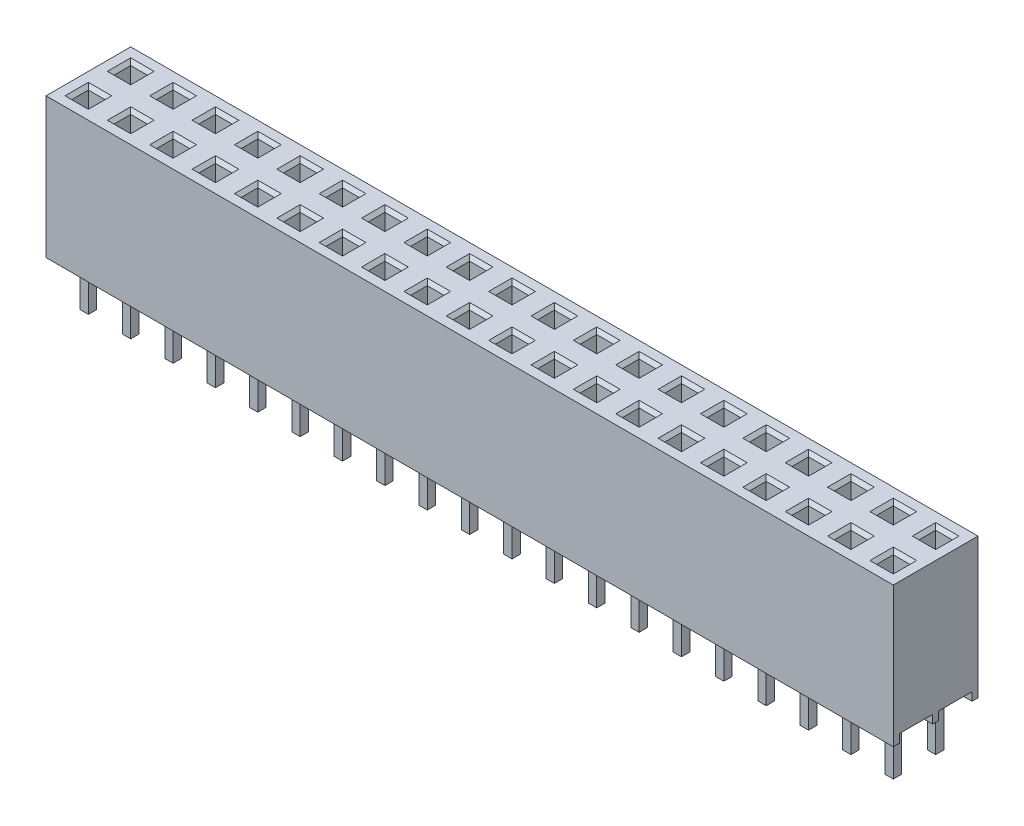
from build123d import *

# Parameters (mm, degrees)
SKETCH_1_W                         = 12.7
SKETCH_1_H                         = 5.08
EXTRUDE_1_DEPTH                    = 8.4
CUT_EXTRUDE_1_REACH                = 17.437
SKETCH_2_W                         = 2
SKETCH_2_H                         = 0.5
CUT_EXTRUDE_2_REACH                = 12.449
SKETCH_3_W                         = 1
SKETCH_3_H                         = 1
CHAMFER_1_SIZE                     = 0.2
PATTERN_LINEAR_3_COUNT             = 4
PATTERN_LINEAR_3_PITCH             = 12.7
CHAMFER_1_OF_PATTERN_LINEAR_3_SIZE = 0.2
EXTRUDE_2_DEPTH                    = 3.2
EXTRUDE_2_DEPTH_BACK               = 3.2
SKETCH_4_W                         = 0.5
SKETCH_4_H                         = 0.5
EXTRUDE_2_2_DEPTH                  = 3.2
EXTRUDE_2_2_DEPTH_BACK             = 3.2
EXTRUDE_2_3_DEPTH                  = 3.2
EXTRUDE_2_3_DEPTH_BACK             = 3.2
EXTRUDE_2_4_DEPTH                  = 3.2
EXTRUDE_2_4_DEPTH_BACK             = 3.2
EXTRUDE_2_5_DEPTH                  = 3.2
EXTRUDE_2_5_DEPTH_BACK             = 3.2
EXTRUDE_2_6_DEPTH                  = 3.2
EXTRUDE_2_6_DEPTH_BACK             = 3.2
EXTRUDE_2_7_DEPTH                  = 3.2
EXTRUDE_2_7_DEPTH_BACK             = 3.2
EXTRUDE_2_8_DEPTH                  = 3.2
EXTRUDE_2_8_DEPTH_BACK             = 3.2
EXTRUDE_2_9_DEPTH                  = 3.2
EXTRUDE_2_9_DEPTH_BACK             = 3.2
EXTRUDE_2_10_DEPTH                 = 3.2
EXTRUDE_2_10_DEPTH_BACK            = 3.2
EXTRUDE_2_11_DEPTH                 = 3.2
EXTRUDE_2_11_DEPTH_BACK            = 3.2
EXTRUDE_2_12_DEPTH                 = 3.2
EXTRUDE_2_12_DEPTH_BACK            = 3.2
EXTRUDE_2_13_DEPTH                 = 3.2
EXTRUDE_2_13_DEPTH_BACK            = 3.2
EXTRUDE_2_14_DEPTH                 = 3.2
EXTRUDE_2_14_DEPTH_BACK            = 3.2
EXTRUDE_2_15_DEPTH                 = 3.2
EXTRUDE_2_15_DEPTH_BACK            = 3.2
EXTRUDE_2_16_DEPTH                 = 3.2
EXTRUDE_2_16_DEPTH_BACK            = 3.2
EXTRUDE_2_17_DEPTH                 = 3.2
EXTRUDE_2_17_DEPTH_BACK            = 3.2
EXTRUDE_2_18_DEPTH                 = 3.2
EXTRUDE_2_18_DEPTH_BACK            = 3.2
EXTRUDE_2_19_DEPTH                 = 3.2
EXTRUDE_2_19_DEPTH_BACK            = 3.2
EXTRUDE_2_20_DEPTH                 = 3.2
EXTRUDE_2_20_DEPTH_BACK            = 3.2
EXTRUDE_2_21_DEPTH                 = 3.2
EXTRUDE_2_21_DEPTH_BACK            = 3.2
EXTRUDE_2_22_DEPTH                 = 3.2
EXTRUDE_2_22_DEPTH_BACK            = 3.2
EXTRUDE_2_23_DEPTH                 = 3.2
EXTRUDE_2_23_DEPTH_BACK            = 3.2
EXTRUDE_2_24_DEPTH                 = 3.2
EXTRUDE_2_24_DEPTH_BACK            = 3.2
EXTRUDE_2_25_DEPTH                 = 3.2
EXTRUDE_2_25_DEPTH_BACK            = 3.2
EXTRUDE_2_26_DEPTH                 = 3.2
EXTRUDE_2_26_DEPTH_BACK            = 3.2
EXTRUDE_2_27_DEPTH                 = 3.2
EXTRUDE_2_27_DEPTH_BACK            = 3.2
EXTRUDE_2_28_DEPTH                 = 3.2
EXTRUDE_2_28_DEPTH_BACK            = 3.2
EXTRUDE_2_29_DEPTH                 = 3.2
EXTRUDE_2_29_DEPTH_BACK            = 3.2
EXTRUDE_2_30_DEPTH                 = 3.2
EXTRUDE_2_30_DEPTH_BACK            = 3.2
EXTRUDE_2_31_DEPTH                 = 3.2
EXTRUDE_2_31_DEPTH_BACK            = 3.2
EXTRUDE_2_32_DEPTH                 = 3.2
EXTRUDE_2_32_DEPTH_BACK            = 3.2
EXTRUDE_2_33_DEPTH                 = 3.2
EXTRUDE_2_33_DEPTH_BACK            = 3.2
EXTRUDE_2_34_DEPTH                 = 3.2
EXTRUDE_2_34_DEPTH_BACK            = 3.2
EXTRUDE_2_35_DEPTH                 = 3.2
EXTRUDE_2_35_DEPTH_BACK            = 3.2
EXTRUDE_2_36_DEPTH                 = 3.2
EXTRUDE_2_36_DEPTH_BACK            = 3.2
EXTRUDE_2_37_DEPTH                 = 3.2
EXTRUDE_2_37_DEPTH_BACK            = 3.2
EXTRUDE_2_38_DEPTH                 = 3.2
EXTRUDE_2_38_DEPTH_BACK            = 3.2
EXTRUDE_2_39_DEPTH                 = 3.2
EXTRUDE_2_39_DEPTH_BACK            = 3.2
EXTRUDE_2_40_DEPTH                 = 3.2
EXTRUDE_2_40_DEPTH_BACK            = 3.2


with BuildPart() as part:
    # Эскиз1 → Бобышка-Вытянуть1 (new body)
    with BuildSketch(Plane(origin=(0, 0, 0), x_dir=(1, 0, 0), z_dir=(0, 1, 0))):
        Rectangle(SKETCH_1_W, SKETCH_1_H)
    extrude_1 = extrude(amount=EXTRUDE_1_DEPTH)

    # Эскиз2 → Вырез-Вытянуть1 (cut, up to next)
    with BuildSketch(Plane(origin=(6.35, 0, 0), x_dir=(0, 0, -1), z_dir=(1, 0, 0)), mode=Mode.PRIVATE) as cut_extrude_1_sk1:
        with Locations((-1.18, 0.25)):
            Rectangle(SKETCH_2_W, SKETCH_2_H)
    cut_extrude_1_tool1 = extrude(cut_extrude_1_sk1.sketch, amount=-CUT_EXTRUDE_1_REACH, mode=Mode.PRIVATE) & part.part
    # Эскиз2 → Вырез-Вытянуть1 (cut, up to next)
    with BuildSketch(Plane(origin=(6.35, 0, 0), x_dir=(0, 0, -1), z_dir=(1, 0, 0)), mode=Mode.PRIVATE) as cut_extrude_1_sk2:
        with Locations((1.18, 0.25)):
            Rectangle(SKETCH_2_W, SKETCH_2_H)
    cut_extrude_1_tool2 = extrude(cut_extrude_1_sk2.sketch, amount=-CUT_EXTRUDE_1_REACH, mode=Mode.PRIVATE) & part.part
    cut_extrude_1_1 = cut_extrude_1_tool1.solids().sort_by_distance((6.35, 0.25, 1.18))[0]
    add(cut_extrude_1_1, mode=Mode.SUBTRACT)
    cut_extrude_1_2 = cut_extrude_1_tool2.solids().sort_by_distance((6.35, 0.25, -1.18))[0]
    add(cut_extrude_1_2, mode=Mode.SUBTRACT)
    cut_extrude_1 = cut_extrude_1_1 + cut_extrude_1_2  # Вырез-Вытянуть1 as one shape, for the pattern or mirror that repeats it

    # Эскиз3 → Вырез-Вытянуть2 (cut, up to next)
    with BuildSketch(Plane.XZ.offset(-0.5), mode=Mode.PRIVATE) as cut_extrude_2_sk1:
        with Locations((-5.08, 1.27)):
            Rectangle(SKETCH_3_W, SKETCH_3_H)
    cut_extrude_2_tool1 = extrude(cut_extrude_2_sk1.sketch, amount=-CUT_EXTRUDE_2_REACH, mode=Mode.PRIVATE) & part.part
    # Эскиз3 → Вырез-Вытянуть2 (cut, up to next)
    with BuildSketch(Plane.XZ.offset(-0.5), mode=Mode.PRIVATE) as cut_extrude_2_sk2:
        with Locations((-5.08, -1.27)):
            Rectangle(SKETCH_3_W, SKETCH_3_H)
    cut_extrude_2_tool2 = extrude(cut_extrude_2_sk2.sketch, amount=-CUT_EXTRUDE_2_REACH, mode=Mode.PRIVATE) & part.part
    # Эскиз3 → Вырез-Вытянуть2 (cut, up to next)
    with BuildSketch(Plane.XZ.offset(-0.5), mode=Mode.PRIVATE) as cut_extrude_2_sk3:
        with Locations((-2.54, 1.27)):
            Rectangle(SKETCH_3_W, SKETCH_3_H)
    cut_extrude_2_tool3 = extrude(cut_extrude_2_sk3.sketch, amount=-CUT_EXTRUDE_2_REACH, mode=Mode.PRIVATE) & part.part
    # Эскиз3 → Вырез-Вытянуть2 (cut, up to next)
    with BuildSketch(Plane.XZ.offset(-0.5), mode=Mode.PRIVATE) as cut_extrude_2_sk4:
        with Locations((-2.54, -1.27)):
            Rectangle(SKETCH_3_W, SKETCH_3_H)
    cut_extrude_2_tool4 = extrude(cut_extrude_2_sk4.sketch, amount=-CUT_EXTRUDE_2_REACH, mode=Mode.PRIVATE) & part.part
    # Эскиз3 → Вырез-Вытянуть2 (cut, up to next)
    with BuildSketch(Plane.XZ.offset(-0.5), mode=Mode.PRIVATE) as cut_extrude_2_sk5:
        with Locations((0, 1.27)):
            Rectangle(SKETCH_3_W, SKETCH_3_H)
    cut_extrude_2_tool5 = extrude(cut_extrude_2_sk5.sketch, amount=-CUT_EXTRUDE_2_REACH, mode=Mode.PRIVATE) & part.part
    # Эскиз3 → Вырез-Вытянуть2 (cut, up to next)
    with BuildSketch(Plane.XZ.offset(-0.5), mode=Mode.PRIVATE) as cut_extrude_2_sk6:
        with Locations((0, -1.27)):
            Rectangle(SKETCH_3_W, SKETCH_3_H)
    cut_extrude_2_tool6 = extrude(cut_extrude_2_sk6.sketch, amount=-CUT_EXTRUDE_2_REACH, mode=Mode.PRIVATE) & part.part
    # Эскиз3 → Вырез-Вытянуть2 (cut, up to next)
    with BuildSketch(Plane.XZ.offset(-0.5), mode=Mode.PRIVATE) as cut_extrude_2_sk7:
        with Locations((2.54, 1.27)):
            Rectangle(SKETCH_3_W, SKETCH_3_H)
    cut_extrude_2_tool7 = extrude(cut_extrude_2_sk7.sketch, amount=-CUT_EXTRUDE_2_REACH, mode=Mode.PRIVATE) & part.part
    # Эскиз3 → Вырез-Вытянуть2 (cut, up to next)
    with BuildSketch(Plane.XZ.offset(-0.5), mode=Mode.PRIVATE) as cut_extrude_2_sk8:
        with Locations((2.54, -1.27)):
            Rectangle(SKETCH_3_W, SKETCH_3_H)
    cut_extrude_2_tool8 = extrude(cut_extrude_2_sk8.sketch, amount=-CUT_EXTRUDE_2_REACH, mode=Mode.PRIVATE) & part.part
    # Эскиз3 → Вырез-Вытянуть2 (cut, up to next)
    with BuildSketch(Plane.XZ.offset(-0.5), mode=Mode.PRIVATE) as cut_extrude_2_sk9:
        with Locations((5.08, 1.27)):
            Rectangle(SKETCH_3_W, SKETCH_3_H)
    cut_extrude_2_tool9 = extrude(cut_extrude_2_sk9.sketch, amount=-CUT_EXTRUDE_2_REACH, mode=Mode.PRIVATE) & part.part
    # Эскиз3 → Вырез-Вытянуть2 (cut, up to next)
    with BuildSketch(Plane.XZ.offset(-0.5), mode=Mode.PRIVATE) as cut_extrude_2_sk10:
        with Locations((5.08, -1.27)):
            Rectangle(SKETCH_3_W, SKETCH_3_H)
    cut_extrude_2_tool10 = extrude(cut_extrude_2_sk10.sketch, amount=-CUT_EXTRUDE_2_REACH, mode=Mode.PRIVATE) & part.part
    cut_extrude_2_1 = cut_extrude_2_tool1.solids().sort_by_distance((-5.08, 0.5, 1.27))[0]
    add(cut_extrude_2_1, mode=Mode.SUBTRACT)
    cut_extrude_2_2 = cut_extrude_2_tool2.solids().sort_by_distance((-5.08, 0.5, -1.27))[0]
    add(cut_extrude_2_2, mode=Mode.SUBTRACT)
    cut_extrude_2_3 = cut_extrude_2_tool3.solids().sort_by_distance((-2.54, 0.5, 1.27))[0]
    add(cut_extrude_2_3, mode=Mode.SUBTRACT)
    cut_extrude_2_4 = cut_extrude_2_tool4.solids().sort_by_distance((-2.54, 0.5, -1.27))[0]
    add(cut_extrude_2_4, mode=Mode.SUBTRACT)
    cut_extrude_2_5 = cut_extrude_2_tool5.solids().sort_by_distance((0, 0.5, 1.27))[0]
    add(cut_extrude_2_5, mode=Mode.SUBTRACT)
    cut_extrude_2_6 = cut_extrude_2_tool6.solids().sort_by_distance((0, 0.5, -1.27))[0]
    add(cut_extrude_2_6, mode=Mode.SUBTRACT)
    cut_extrude_2_7 = cut_extrude_2_tool7.solids().sort_by_distance((2.54, 0.5, 1.27))[0]
    add(cut_extrude_2_7, mode=Mode.SUBTRACT)
    cut_extrude_2_8 = cut_extrude_2_tool8.solids().sort_by_distance((2.54, 0.5, -1.27))[0]
    add(cut_extrude_2_8, mode=Mode.SUBTRACT)
    cut_extrude_2_9 = cut_extrude_2_tool9.solids().sort_by_distance((5.08, 0.5, 1.27))[0]
    add(cut_extrude_2_9, mode=Mode.SUBTRACT)
    cut_extrude_2_10 = cut_extrude_2_tool10.solids().sort_by_distance((5.08, 0.5, -1.27))[0]
    add(cut_extrude_2_10, mode=Mode.SUBTRACT)
    cut_extrude_2 = cut_extrude_2_1 + cut_extrude_2_2 + cut_extrude_2_3 + cut_extrude_2_4 + cut_extrude_2_5 + cut_extrude_2_6 + cut_extrude_2_7 + cut_extrude_2_8 + cut_extrude_2_9 + cut_extrude_2_10  # Вырез-Вытянуть2 as one shape, for the pattern or mirror that repeats it

    # Фаска1
    chamfer_1_edges = [part.edges().sort_by_distance(p)[0] for p in [
        (0.5, 8.4, -1.27),
        (0, 8.4, -1.77),
        (-0.5, 8.4, -1.27),
        (0, 8.4, -0.77),
        (2.54, 8.4, 1.77),
        (3.04, 8.4, 1.27),
        (2.54, 8.4, 0.77),
        (2.04, 8.4, 1.27),
        (3.04, 8.4, -1.27),
        (2.54, 8.4, -1.77),
        (2.04, 8.4, -1.27),
        (2.54, 8.4, -0.77),
        (5.08, 8.4, 1.77),
        (5.58, 8.4, 1.27),
        (5.08, 8.4, 0.77),
        (4.58, 8.4, 1.27),
        (5.58, 8.4, -1.27),
        (5.08, 8.4, -1.77),
        (4.58, 8.4, -1.27),
        (5.08, 8.4, -0.77),
        (-5.58, 8.4, 1.27),
        (-5.08, 8.4, 1.77),
        (-4.58, 8.4, 1.27),
        (-5.08, 8.4, 0.77),
        (-5.08, 8.4, -1.77),
        (-5.58, 8.4, -1.27),
        (-5.08, 8.4, -0.77),
        (-4.58, 8.4, -1.27),
        (-2.54, 8.4, 1.77),
        (-2.04, 8.4, 1.27),
        (-2.54, 8.4, 0.77),
        (-3.04, 8.4, 1.27),
        (-2.04, 8.4, -1.27),
        (-2.54, 8.4, -1.77),
        (-3.04, 8.4, -1.27),
        (-2.54, 8.4, -0.77),
        (0, 8.4, 1.77),
        (0.5, 8.4, 1.27),
        (0, 8.4, 0.77),
        (-0.5, 8.4, 1.27),
    ]]
    chamfer(chamfer_1_edges, length=CHAMFER_1_SIZE)

    # Линейный массив3: Бобышка-Вытянуть1, Вырез-Вытянуть1, Вырез-Вытянуть2 ×4
    with Locations(*[(i * PATTERN_LINEAR_3_PITCH, 0, 0) for i in range(1, PATTERN_LINEAR_3_COUNT)]):
        add(extrude_1)
        add(cut_extrude_1, mode=Mode.SUBTRACT)
        add(cut_extrude_2, mode=Mode.SUBTRACT)

    # Фаска1 of Линейный массив3
    chamfer_1_of_pattern_linear_3_edges = [part.edges().sort_by_distance(p)[0] for p in [
        (13.2, 8.4, -1.27),
        (12.7, 8.4, -1.77),
        (12.2, 8.4, -1.27),
        (12.7, 8.4, -0.77),
        (15.24, 8.4, 1.77),
        (15.74, 8.4, 1.27),
        (15.24, 8.4, 0.77),
        (14.74, 8.4, 1.27),
        (15.74, 8.4, -1.27),
        (15.24, 8.4, -1.77),
        (14.74, 8.4, -1.27),
        (15.24, 8.4, -0.77),
        (17.78, 8.4, 1.77),
        (18.28, 8.4, 1.27),
        (17.78, 8.4, 0.77),
        (17.28, 8.4, 1.27),
        (18.28, 8.4, -1.27),
        (17.78, 8.4, -1.77),
        (17.28, 8.4, -1.27),
        (17.78, 8.4, -0.77),
        (7.12, 8.4, 1.27),
        (7.62, 8.4, 1.77),
        (8.12, 8.4, 1.27),
        (7.62, 8.4, 0.77),
        (7.62, 8.4, -1.77),
        (7.12, 8.4, -1.27),
        (7.62, 8.4, -0.77),
        (8.12, 8.4, -1.27),
        (10.16, 8.4, 1.77),
        (10.66, 8.4, 1.27),
        (10.16, 8.4, 0.77),
        (9.66, 8.4, 1.27),
        (10.66, 8.4, -1.27),
        (10.16, 8.4, -1.77),
        (9.66, 8.4, -1.27),
        (10.16, 8.4, -0.77),
        (12.7, 8.4, 1.77),
        (13.2, 8.4, 1.27),
        (12.7, 8.4, 0.77),
        (12.2, 8.4, 1.27),
        (25.9, 8.4, -1.27),
        (25.4, 8.4, -1.77),
        (24.9, 8.4, -1.27),
        (25.4, 8.4, -0.77),
        (27.94, 8.4, 1.77),
        (28.44, 8.4, 1.27),
        (27.94, 8.4, 0.77),
        (27.44, 8.4, 1.27),
        (28.44, 8.4, -1.27),
        (27.94, 8.4, -1.77),
        (27.44, 8.4, -1.27),
        (27.94, 8.4, -0.77),
        (30.48, 8.4, 1.77),
        (30.98, 8.4, 1.27),
        (30.48, 8.4, 0.77),
        (29.98, 8.4, 1.27),
        (30.98, 8.4, -1.27),
        (30.48, 8.4, -1.77),
        (29.98, 8.4, -1.27),
        (30.48, 8.4, -0.77),
        (19.82, 8.4, 1.27),
        (20.32, 8.4, 1.77),
        (20.82, 8.4, 1.27),
        (20.32, 8.4, 0.77),
        (20.32, 8.4, -1.77),
        (19.82, 8.4, -1.27),
        (20.32, 8.4, -0.77),
        (20.82, 8.4, -1.27),
        (22.86, 8.4, 1.77),
        (23.36, 8.4, 1.27),
        (22.86, 8.4, 0.77),
        (22.36, 8.4, 1.27),
        (23.36, 8.4, -1.27),
        (22.86, 8.4, -1.77),
        (22.36, 8.4, -1.27),
        (22.86, 8.4, -0.77),
        (25.4, 8.4, 1.77),
        (25.9, 8.4, 1.27),
        (25.4, 8.4, 0.77),
        (24.9, 8.4, 1.27),
        (38.6, 8.4, -1.27),
        (38.1, 8.4, -1.77),
        (37.6, 8.4, -1.27),
        (38.1, 8.4, -0.77),
        (40.64, 8.4, 1.77),
        (41.14, 8.4, 1.27),
        (40.64, 8.4, 0.77),
        (40.14, 8.4, 1.27),
        (41.14, 8.4, -1.27),
        (40.64, 8.4, -1.77),
        (40.14, 8.4, -1.27),
        (40.64, 8.4, -0.77),
        (43.18, 8.4, 1.77),
        (43.68, 8.4, 1.27),
        (43.18, 8.4, 0.77),
        (42.68, 8.4, 1.27),
        (43.68, 8.4, -1.27),
        (43.18, 8.4, -1.77),
        (42.68, 8.4, -1.27),
        (43.18, 8.4, -0.77),
        (32.52, 8.4, 1.27),
        (33.02, 8.4, 1.77),
        (33.52, 8.4, 1.27),
        (33.02, 8.4, 0.77),
        (33.02, 8.4, -1.77),
        (32.52, 8.4, -1.27),
        (33.02, 8.4, -0.77),
        (33.52, 8.4, -1.27),
        (35.56, 8.4, 1.77),
        (36.06, 8.4, 1.27),
        (35.56, 8.4, 0.77),
        (35.06, 8.4, 1.27),
        (36.06, 8.4, -1.27),
        (35.56, 8.4, -1.77),
        (35.06, 8.4, -1.27),
        (35.56, 8.4, -0.77),
        (38.1, 8.4, 1.77),
        (38.6, 8.4, 1.27),
        (38.1, 8.4, 0.77),
        (37.6, 8.4, 1.27),
    ]]
    chamfer(chamfer_1_of_pattern_linear_3_edges, length=CHAMFER_1_OF_PATTERN_LINEAR_3_SIZE)


with BuildPart() as body_2:
    # Эскиз4 → Бобышка-Вытянуть2 (new, two sides: drawn at the far end of the back side and taken through both)
    with BuildSketch(Plane.XZ.offset(-0.5).offset(-EXTRUDE_2_DEPTH_BACK)):
        with Locations((-5.08, 1.27)):
            Rectangle(SKETCH_4_W, SKETCH_4_H)
    extrude(amount=EXTRUDE_2_DEPTH + EXTRUDE_2_DEPTH_BACK)


with BuildPart() as body_3:
    # Эскиз4 → Extrude 2 2 (new, two sides: drawn at the far end of the back side and taken through both)
    with BuildSketch(Plane.XZ.offset(-0.5).offset(-EXTRUDE_2_2_DEPTH_BACK)):
        with Locations((-5.08, -1.27)):
            Rectangle(SKETCH_4_W, SKETCH_4_H)
    extrude(amount=EXTRUDE_2_2_DEPTH + EXTRUDE_2_2_DEPTH_BACK)


with BuildPart() as body_4:
    # Эскиз4 → Extrude 2 3 (new, two sides: drawn at the far end of the back side and taken through both)
    with BuildSketch(Plane.XZ.offset(-0.5).offset(-EXTRUDE_2_3_DEPTH_BACK)):
        with Locations((-2.54, 1.27)):
            Rectangle(SKETCH_4_W, SKETCH_4_H)
    extrude(amount=EXTRUDE_2_3_DEPTH + EXTRUDE_2_3_DEPTH_BACK)


with BuildPart() as body_5:
    # Эскиз4 → Extrude 2 4 (new, two sides: drawn at the far end of the back side and taken through both)
    with BuildSketch(Plane.XZ.offset(-0.5).offset(-EXTRUDE_2_4_DEPTH_BACK)):
        with Locations((-2.54, -1.27)):
            Rectangle(SKETCH_4_W, SKETCH_4_H)
    extrude(amount=EXTRUDE_2_4_DEPTH + EXTRUDE_2_4_DEPTH_BACK)


with BuildPart() as body_6:
    # Эскиз4 → Extrude 2 5 (new, two sides: drawn at the far end of the back side and taken through both)
    with BuildSketch(Plane.XZ.offset(-0.5).offset(-EXTRUDE_2_5_DEPTH_BACK)):
        with Locations((0, 1.27)):
            Rectangle(SKETCH_4_W, SKETCH_4_H)
    extrude(amount=EXTRUDE_2_5_DEPTH + EXTRUDE_2_5_DEPTH_BACK)


with BuildPart() as body_7:
    # Эскиз4 → Extrude 2 6 (new, two sides: drawn at the far end of the back side and taken through both)
    with BuildSketch(Plane.XZ.offset(-0.5).offset(-EXTRUDE_2_6_DEPTH_BACK)):
        with Locations((0, -1.27)):
            Rectangle(SKETCH_4_W, SKETCH_4_H)
    extrude(amount=EXTRUDE_2_6_DEPTH + EXTRUDE_2_6_DEPTH_BACK)


with BuildPart() as body_8:
    # Эскиз4 → Extrude 2 7 (new, two sides: drawn at the far end of the back side and taken through both)
    with BuildSketch(Plane.XZ.offset(-0.5).offset(-EXTRUDE_2_7_DEPTH_BACK)):
        with Locations((2.54, 1.27)):
            Rectangle(SKETCH_4_W, SKETCH_4_H)
    extrude(amount=EXTRUDE_2_7_DEPTH + EXTRUDE_2_7_DEPTH_BACK)


with BuildPart() as body_9:
    # Эскиз4 → Extrude 2 8 (new, two sides: drawn at the far end of the back side and taken through both)
    with BuildSketch(Plane.XZ.offset(-0.5).offset(-EXTRUDE_2_8_DEPTH_BACK)):
        with Locations((2.54, -1.27)):
            Rectangle(SKETCH_4_W, SKETCH_4_H)
    extrude(amount=EXTRUDE_2_8_DEPTH + EXTRUDE_2_8_DEPTH_BACK)


with BuildPart() as body_10:
    # Эскиз4 → Extrude 2 9 (new, two sides: drawn at the far end of the back side and taken through both)
    with BuildSketch(Plane.XZ.offset(-0.5).offset(-EXTRUDE_2_9_DEPTH_BACK)):
        with Locations((5.08, 1.27)):
            Rectangle(SKETCH_4_W, SKETCH_4_H)
    extrude(amount=EXTRUDE_2_9_DEPTH + EXTRUDE_2_9_DEPTH_BACK)


with BuildPart() as body_11:
    # Эскиз4 → Extrude 2 10 (new, two sides: drawn at the far end of the back side and taken through both)
    with BuildSketch(Plane.XZ.offset(-0.5).offset(-EXTRUDE_2_10_DEPTH_BACK)):
        with Locations((5.08, -1.27)):
            Rectangle(SKETCH_4_W, SKETCH_4_H)
    extrude(amount=EXTRUDE_2_10_DEPTH + EXTRUDE_2_10_DEPTH_BACK)


with BuildPart() as body_12:
    # Эскиз4 → Extrude 2 11 (new, two sides: drawn at the far end of the back side and taken through both)
    with BuildSketch(Plane.XZ.offset(-0.5).offset(-EXTRUDE_2_11_DEPTH_BACK)):
        with Locations((7.62, 1.27)):
            Rectangle(SKETCH_4_W, SKETCH_4_H)
    extrude(amount=EXTRUDE_2_11_DEPTH + EXTRUDE_2_11_DEPTH_BACK)


with BuildPart() as body_13:
    # Эскиз4 → Extrude 2 12 (new, two sides: drawn at the far end of the back side and taken through both)
    with BuildSketch(Plane.XZ.offset(-0.5).offset(-EXTRUDE_2_12_DEPTH_BACK)):
        with Locations((7.62, -1.27)):
            Rectangle(SKETCH_4_W, SKETCH_4_H)
    extrude(amount=EXTRUDE_2_12_DEPTH + EXTRUDE_2_12_DEPTH_BACK)


with BuildPart() as body_14:
    # Эскиз4 → Extrude 2 13 (new, two sides: drawn at the far end of the back side and taken through both)
    with BuildSketch(Plane.XZ.offset(-0.5).offset(-EXTRUDE_2_13_DEPTH_BACK)):
        with Locations((10.16, 1.27)):
            Rectangle(SKETCH_4_W, SKETCH_4_H)
    extrude(amount=EXTRUDE_2_13_DEPTH + EXTRUDE_2_13_DEPTH_BACK)


with BuildPart() as body_15:
    # Эскиз4 → Extrude 2 14 (new, two sides: drawn at the far end of the back side and taken through both)
    with BuildSketch(Plane.XZ.offset(-0.5).offset(-EXTRUDE_2_14_DEPTH_BACK)):
        with Locations((10.16, -1.27)):
            Rectangle(SKETCH_4_W, SKETCH_4_H)
    extrude(amount=EXTRUDE_2_14_DEPTH + EXTRUDE_2_14_DEPTH_BACK)


with BuildPart() as body_16:
    # Эскиз4 → Extrude 2 15 (new, two sides: drawn at the far end of the back side and taken through both)
    with BuildSketch(Plane.XZ.offset(-0.5).offset(-EXTRUDE_2_15_DEPTH_BACK)):
        with Locations((12.7, 1.27)):
            Rectangle(SKETCH_4_W, SKETCH_4_H)
    extrude(amount=EXTRUDE_2_15_DEPTH + EXTRUDE_2_15_DEPTH_BACK)


with BuildPart() as body_17:
    # Эскиз4 → Extrude 2 16 (new, two sides: drawn at the far end of the back side and taken through both)
    with BuildSketch(Plane.XZ.offset(-0.5).offset(-EXTRUDE_2_16_DEPTH_BACK)):
        with Locations((12.7, -1.27)):
            Rectangle(SKETCH_4_W, SKETCH_4_H)
    extrude(amount=EXTRUDE_2_16_DEPTH + EXTRUDE_2_16_DEPTH_BACK)


with BuildPart() as body_18:
    # Эскиз4 → Extrude 2 17 (new, two sides: drawn at the far end of the back side and taken through both)
    with BuildSketch(Plane.XZ.offset(-0.5).offset(-EXTRUDE_2_17_DEPTH_BACK)):
        with Locations((15.24, 1.27)):
            Rectangle(SKETCH_4_W, SKETCH_4_H)
    extrude(amount=EXTRUDE_2_17_DEPTH + EXTRUDE_2_17_DEPTH_BACK)


with BuildPart() as body_19:
    # Эскиз4 → Extrude 2 18 (new, two sides: drawn at the far end of the back side and taken through both)
    with BuildSketch(Plane.XZ.offset(-0.5).offset(-EXTRUDE_2_18_DEPTH_BACK)):
        with Locations((15.24, -1.27)):
            Rectangle(SKETCH_4_W, SKETCH_4_H)
    extrude(amount=EXTRUDE_2_18_DEPTH + EXTRUDE_2_18_DEPTH_BACK)


with BuildPart() as body_20:
    # Эскиз4 → Extrude 2 19 (new, two sides: drawn at the far end of the back side and taken through both)
    with BuildSketch(Plane.XZ.offset(-0.5).offset(-EXTRUDE_2_19_DEPTH_BACK)):
        with Locations((17.78, 1.27)):
            Rectangle(SKETCH_4_W, SKETCH_4_H)
    extrude(amount=EXTRUDE_2_19_DEPTH + EXTRUDE_2_19_DEPTH_BACK)


with BuildPart() as body_21:
    # Эскиз4 → Extrude 2 20 (new, two sides: drawn at the far end of the back side and taken through both)
    with BuildSketch(Plane.XZ.offset(-0.5).offset(-EXTRUDE_2_20_DEPTH_BACK)):
        with Locations((17.78, -1.27)):
            Rectangle(SKETCH_4_W, SKETCH_4_H)
    extrude(amount=EXTRUDE_2_20_DEPTH + EXTRUDE_2_20_DEPTH_BACK)


with BuildPart() as body_22:
    # Эскиз4 → Extrude 2 21 (new, two sides: drawn at the far end of the back side and taken through both)
    with BuildSketch(Plane.XZ.offset(-0.5).offset(-EXTRUDE_2_21_DEPTH_BACK)):
        with Locations((20.32, 1.27)):
            Rectangle(SKETCH_4_W, SKETCH_4_H)
    extrude(amount=EXTRUDE_2_21_DEPTH + EXTRUDE_2_21_DEPTH_BACK)


with BuildPart() as body_23:
    # Эскиз4 → Extrude 2 22 (new, two sides: drawn at the far end of the back side and taken through both)
    with BuildSketch(Plane.XZ.offset(-0.5).offset(-EXTRUDE_2_22_DEPTH_BACK)):
        with Locations((20.32, -1.27)):
            Rectangle(SKETCH_4_W, SKETCH_4_H)
    extrude(amount=EXTRUDE_2_22_DEPTH + EXTRUDE_2_22_DEPTH_BACK)


with BuildPart() as body_24:
    # Эскиз4 → Extrude 2 23 (new, two sides: drawn at the far end of the back side and taken through both)
    with BuildSketch(Plane.XZ.offset(-0.5).offset(-EXTRUDE_2_23_DEPTH_BACK)):
        with Locations((22.86, 1.27)):
            Rectangle(SKETCH_4_W, SKETCH_4_H)
    extrude(amount=EXTRUDE_2_23_DEPTH + EXTRUDE_2_23_DEPTH_BACK)


with BuildPart() as body_25:
    # Эскиз4 → Extrude 2 24 (new, two sides: drawn at the far end of the back side and taken through both)
    with BuildSketch(Plane.XZ.offset(-0.5).offset(-EXTRUDE_2_24_DEPTH_BACK)):
        with Locations((22.86, -1.27)):
            Rectangle(SKETCH_4_W, SKETCH_4_H)
    extrude(amount=EXTRUDE_2_24_DEPTH + EXTRUDE_2_24_DEPTH_BACK)


with BuildPart() as body_26:
    # Эскиз4 → Extrude 2 25 (new, two sides: drawn at the far end of the back side and taken through both)
    with BuildSketch(Plane.XZ.offset(-0.5).offset(-EXTRUDE_2_25_DEPTH_BACK)):
        with Locations((25.4, 1.27)):
            Rectangle(SKETCH_4_W, SKETCH_4_H)
    extrude(amount=EXTRUDE_2_25_DEPTH + EXTRUDE_2_25_DEPTH_BACK)


with BuildPart() as body_27:
    # Эскиз4 → Extrude 2 26 (new, two sides: drawn at the far end of the back side and taken through both)
    with BuildSketch(Plane.XZ.offset(-0.5).offset(-EXTRUDE_2_26_DEPTH_BACK)):
        with Locations((25.4, -1.27)):
            Rectangle(SKETCH_4_W, SKETCH_4_H)
    extrude(amount=EXTRUDE_2_26_DEPTH + EXTRUDE_2_26_DEPTH_BACK)


with BuildPart() as body_28:
    # Эскиз4 → Extrude 2 27 (new, two sides: drawn at the far end of the back side and taken through both)
    with BuildSketch(Plane.XZ.offset(-0.5).offset(-EXTRUDE_2_27_DEPTH_BACK)):
        with Locations((27.94, 1.27)):
            Rectangle(SKETCH_4_W, SKETCH_4_H)
    extrude(amount=EXTRUDE_2_27_DEPTH + EXTRUDE_2_27_DEPTH_BACK)


with BuildPart() as body_29:
    # Эскиз4 → Extrude 2 28 (new, two sides: drawn at the far end of the back side and taken through both)
    with BuildSketch(Plane.XZ.offset(-0.5).offset(-EXTRUDE_2_28_DEPTH_BACK)):
        with Locations((27.94, -1.27)):
            Rectangle(SKETCH_4_W, SKETCH_4_H)
    extrude(amount=EXTRUDE_2_28_DEPTH + EXTRUDE_2_28_DEPTH_BACK)


with BuildPart() as body_30:
    # Эскиз4 → Extrude 2 29 (new, two sides: drawn at the far end of the back side and taken through both)
    with BuildSketch(Plane.XZ.offset(-0.5).offset(-EXTRUDE_2_29_DEPTH_BACK)):
        with Locations((30.48, 1.27)):
            Rectangle(SKETCH_4_W, SKETCH_4_H)
    extrude(amount=EXTRUDE_2_29_DEPTH + EXTRUDE_2_29_DEPTH_BACK)


with BuildPart() as body_31:
    # Эскиз4 → Extrude 2 30 (new, two sides: drawn at the far end of the back side and taken through both)
    with BuildSketch(Plane.XZ.offset(-0.5).offset(-EXTRUDE_2_30_DEPTH_BACK)):
        with Locations((30.48, -1.27)):
            Rectangle(SKETCH_4_W, SKETCH_4_H)
    extrude(amount=EXTRUDE_2_30_DEPTH + EXTRUDE_2_30_DEPTH_BACK)


with BuildPart() as body_32:
    # Эскиз4 → Extrude 2 31 (new, two sides: drawn at the far end of the back side and taken through both)
    with BuildSketch(Plane.XZ.offset(-0.5).offset(-EXTRUDE_2_31_DEPTH_BACK)):
        with Locations((33.02, 1.27)):
            Rectangle(SKETCH_4_W, SKETCH_4_H)
    extrude(amount=EXTRUDE_2_31_DEPTH + EXTRUDE_2_31_DEPTH_BACK)


with BuildPart() as body_33:
    # Эскиз4 → Extrude 2 32 (new, two sides: drawn at the far end of the back side and taken through both)
    with BuildSketch(Plane.XZ.offset(-0.5).offset(-EXTRUDE_2_32_DEPTH_BACK)):
        with Locations((33.02, -1.27)):
            Rectangle(SKETCH_4_W, SKETCH_4_H)
    extrude(amount=EXTRUDE_2_32_DEPTH + EXTRUDE_2_32_DEPTH_BACK)


with BuildPart() as body_34:
    # Эскиз4 → Extrude 2 33 (new, two sides: drawn at the far end of the back side and taken through both)
    with BuildSketch(Plane.XZ.offset(-0.5).offset(-EXTRUDE_2_33_DEPTH_BACK)):
        with Locations((35.56, 1.27)):
            Rectangle(SKETCH_4_W, SKETCH_4_H)
    extrude(amount=EXTRUDE_2_33_DEPTH + EXTRUDE_2_33_DEPTH_BACK)


with BuildPart() as body_35:
    # Эскиз4 → Extrude 2 34 (new, two sides: drawn at the far end of the back side and taken through both)
    with BuildSketch(Plane.XZ.offset(-0.5).offset(-EXTRUDE_2_34_DEPTH_BACK)):
        with Locations((35.56, -1.27)):
            Rectangle(SKETCH_4_W, SKETCH_4_H)
    extrude(amount=EXTRUDE_2_34_DEPTH + EXTRUDE_2_34_DEPTH_BACK)


with BuildPart() as body_36:
    # Эскиз4 → Extrude 2 35 (new, two sides: drawn at the far end of the back side and taken through both)
    with BuildSketch(Plane.XZ.offset(-0.5).offset(-EXTRUDE_2_35_DEPTH_BACK)):
        with Locations((38.1, 1.27)):
            Rectangle(SKETCH_4_W, SKETCH_4_H)
    extrude(amount=EXTRUDE_2_35_DEPTH + EXTRUDE_2_35_DEPTH_BACK)


with BuildPart() as body_37:
    # Эскиз4 → Extrude 2 36 (new, two sides: drawn at the far end of the back side and taken through both)
    with BuildSketch(Plane.XZ.offset(-0.5).offset(-EXTRUDE_2_36_DEPTH_BACK)):
        with Locations((38.1, -1.27)):
            Rectangle(SKETCH_4_W, SKETCH_4_H)
    extrude(amount=EXTRUDE_2_36_DEPTH + EXTRUDE_2_36_DEPTH_BACK)


with BuildPart() as body_38:
    # Эскиз4 → Extrude 2 37 (new, two sides: drawn at the far end of the back side and taken through both)
    with BuildSketch(Plane.XZ.offset(-0.5).offset(-EXTRUDE_2_37_DEPTH_BACK)):
        with Locations((40.64, 1.27)):
            Rectangle(SKETCH_4_W, SKETCH_4_H)
    extrude(amount=EXTRUDE_2_37_DEPTH + EXTRUDE_2_37_DEPTH_BACK)


with BuildPart() as body_39:
    # Эскиз4 → Extrude 2 38 (new, two sides: drawn at the far end of the back side and taken through both)
    with BuildSketch(Plane.XZ.offset(-0.5).offset(-EXTRUDE_2_38_DEPTH_BACK)):
        with Locations((40.64, -1.27)):
            Rectangle(SKETCH_4_W, SKETCH_4_H)
    extrude(amount=EXTRUDE_2_38_DEPTH + EXTRUDE_2_38_DEPTH_BACK)


with BuildPart() as body_40:
    # Эскиз4 → Extrude 2 39 (new, two sides: drawn at the far end of the back side and taken through both)
    with BuildSketch(Plane.XZ.offset(-0.5).offset(-EXTRUDE_2_39_DEPTH_BACK)):
        with Locations((43.18, 1.27)):
            Rectangle(SKETCH_4_W, SKETCH_4_H)
    extrude(amount=EXTRUDE_2_39_DEPTH + EXTRUDE_2_39_DEPTH_BACK)


with BuildPart() as body_41:
    # Эскиз4 → Extrude 2 40 (new, two sides: drawn at the far end of the back side and taken through both)
    with BuildSketch(Plane.XZ.offset(-0.5).offset(-EXTRUDE_2_40_DEPTH_BACK)):
        with Locations((43.18, -1.27)):
            Rectangle(SKETCH_4_W, SKETCH_4_H)
    extrude(amount=EXTRUDE_2_40_DEPTH + EXTRUDE_2_40_DEPTH_BACK)


solid = Compound([part.part, body_2.part, body_3.part, body_4.part, body_5.part, body_6.part, body_7.part, body_8.part, body_9.part, body_10.part, body_11.part, body_12.part, body_13.part, body_14.part, body_15.part, body_16.part, body_17.part, body_18.part, body_19.part, body_20.part, body_21.part, body_22.part, body_23.part, body_24.part, body_25.part, body_26.part, body_27.part, body_28.part, body_29.part, body_30.part, body_31.part, body_32.part, body_33.part, body_34.part, body_35.part, body_36.part, body_37.part, body_38.part, body_39.part, body_40.part, body_41.part])
